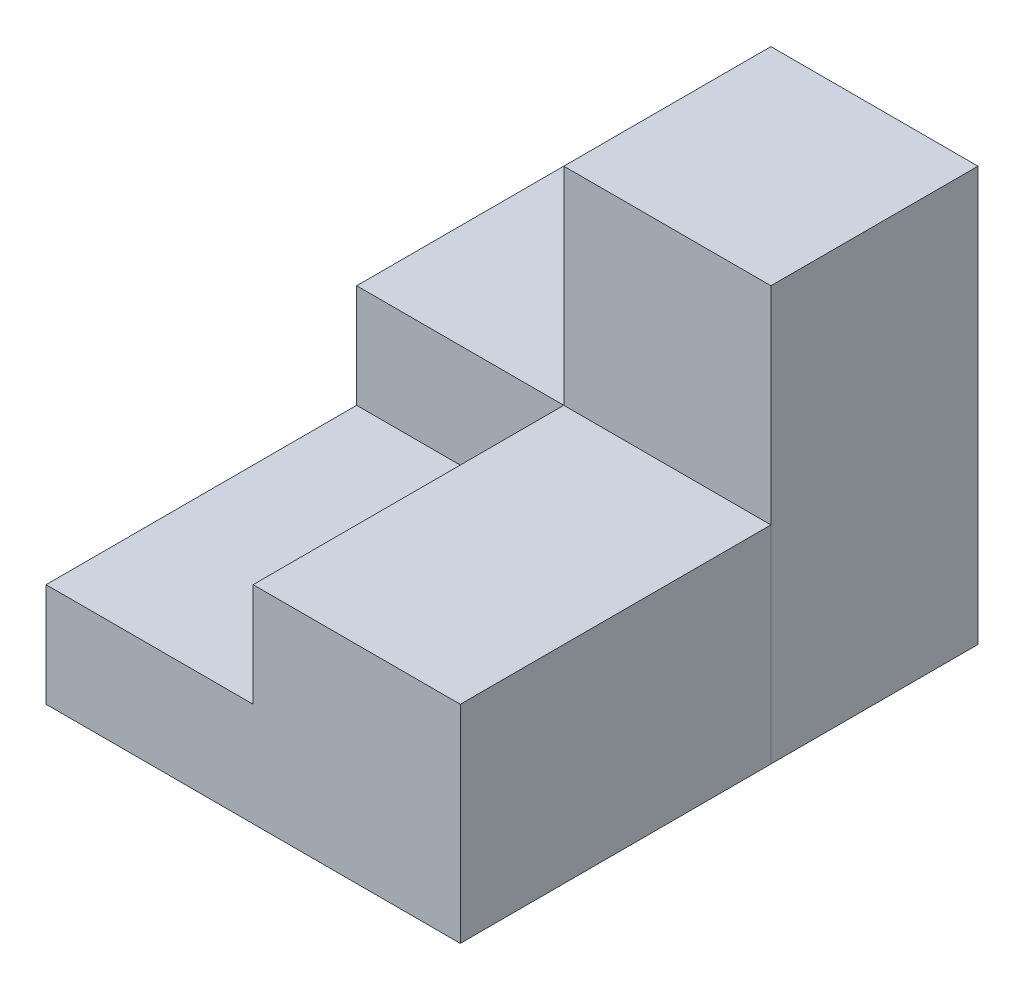
from build123d import *

# Parameters (mm, degrees)
SKETCH1_W            = 20
SKETCH1_H            = 20
BOSS_EXTRUDE7_DEPTH  = 40
SKETCH5_W            = 20
SKETCH5_H            = 20
BOSS_EXTRUDE8_DEPTH  = 20
SKETCH6_W            = 20.003772024
SKETCH6_H            = 30
BOSS_EXTRUDE9_DEPTH  = 20
SKETCH7_W            = 20
SKETCH7_H            = 30
BOSS_EXTRUDE10_DEPTH = 10


with BuildPart() as part:
    # Sketch1 → Boss-Extrude7 (new body)
    with BuildSketch(Plane(origin=(0, 0, 0), x_dir=(1, 0, 0), z_dir=(0, 1, 0))):
        with Locations((10, 10)):
            Rectangle(SKETCH1_W, SKETCH1_H)
    extrude(amount=BOSS_EXTRUDE7_DEPTH)

    # Sketch5 → Boss-Extrude8 (add)
    with BuildSketch(Plane(origin=(0, 0, 0), x_dir=(1, 0, 0), z_dir=(0, 1, 0))):
        with Locations((-10, 10)):
            Rectangle(SKETCH5_W, SKETCH5_H)
    extrude(amount=BOSS_EXTRUDE8_DEPTH)

    # Sketch6 → Boss-Extrude9 (add)
    with BuildSketch(Plane(origin=(0, 0, 0), x_dir=(1, 0, 0), z_dir=(0, 1, 0))):
        with Locations((10.001886012, -15)):
            Rectangle(SKETCH6_W, SKETCH6_H)
    extrude(amount=BOSS_EXTRUDE9_DEPTH)

    # Sketch7 → Boss-Extrude10 (add)
    with BuildSketch(Plane(origin=(0, 0, 0), x_dir=(1, 0, 0), z_dir=(0, 1, 0))):
        with Locations((-10, -15)):
            Rectangle(SKETCH7_W, SKETCH7_H)
    extrude(amount=BOSS_EXTRUDE10_DEPTH)


solid = part.part
